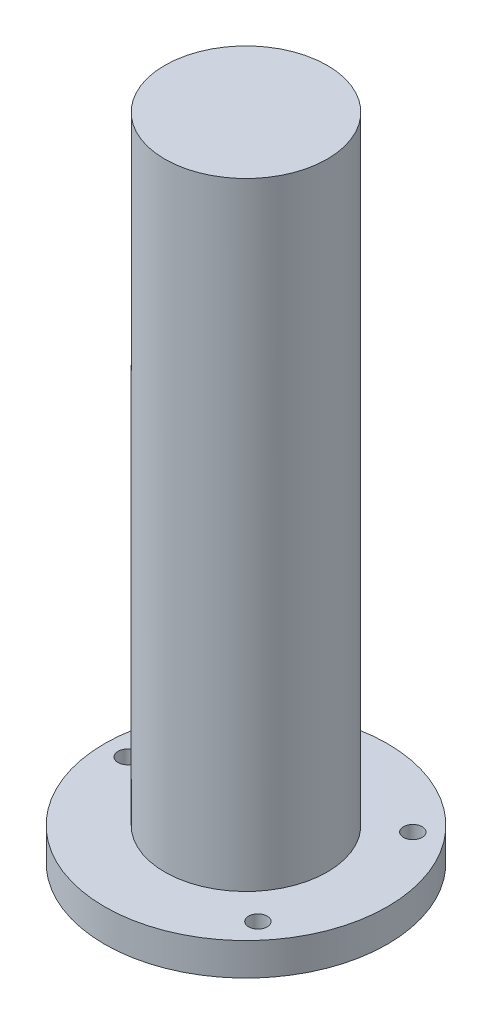
from build123d import *

# Parameters (mm, degrees)
SKETCH1_R           = 22.098
BOSS_EXTRUDE1_DEPTH = 5.08
SKETCH4_R           = 1.4605
SKETCH4_R_2         = 1.524
CUT_EXTRUDE1_DEPTH  = 58.42
SKETCH5_R           = 12.7
CUT_EXTRUDE2_DEPTH  = 29.21
SKETCH5_3_R         = 12.7
BOSS_EXTRUDE2_DEPTH = 101.6
SKETCH6_R           = 7.62
CUT_EXTRUDE3_DEPTH  = 17.78
SKETCH7_W           = 15.24
SKETCH7_H           = 11.096968574
CUT_EXTRUDE4_DEPTH  = 107.297710267


with BuildPart() as part:
    # Sketch1 → Boss-Extrude1 (new body)
    with BuildSketch(Plane(origin=(0, 0, 0), x_dir=(1, 0, 0), z_dir=(0, 1, 0))):
        Circle(SKETCH1_R)
    extrude(amount=BOSS_EXTRUDE1_DEPTH)

    # Sketch4 → Cut-Extrude1 (cut)
    with BuildSketch(Plane(origin=(0, 5.08, 0), x_dir=(1, 0, 0), z_dir=(0, 1, 0))):
        with Locations((13.96833752, 12.106825614)):
            Circle(SKETCH4_R)
        with Locations((13.96833752, -12.106825614)):
            Circle(SKETCH4_R)
        with Locations((-18.48485, 0)):
            Circle(SKETCH4_R_2)
    extrude(amount=-CUT_EXTRUDE1_DEPTH, mode=Mode.SUBTRACT)

    # Sketch5 → Cut-Extrude2 (cut)
    with BuildSketch(Plane.XZ):
        Circle(SKETCH5_R)
    extrude(amount=-CUT_EXTRUDE2_DEPTH, mode=Mode.SUBTRACT)

    # Sketch5<3> → Boss-Extrude2 (add)
    with BuildSketch(Plane.XZ):
        Circle(SKETCH5_3_R)
    extrude(amount=-BOSS_EXTRUDE2_DEPTH)

    # Sketch6 → Cut-Extrude3 (cut)
    with BuildSketch(Plane.XZ):
        Circle(SKETCH6_R)
    extrude(amount=-CUT_EXTRUDE3_DEPTH, mode=Mode.SUBTRACT)

    # Sketch7 → Cut-Extrude4 (cut, through all)
    with BuildSketch(Plane(origin=(0, 0, 0), x_dir=(0, 0, -1), z_dir=(1, 0, 0))):
        with Locations((0, 10.628484287)):
            Rectangle(SKETCH7_W, SKETCH7_H)
    extrude(amount=-CUT_EXTRUDE4_DEPTH, mode=Mode.SUBTRACT)


solid = part.part
